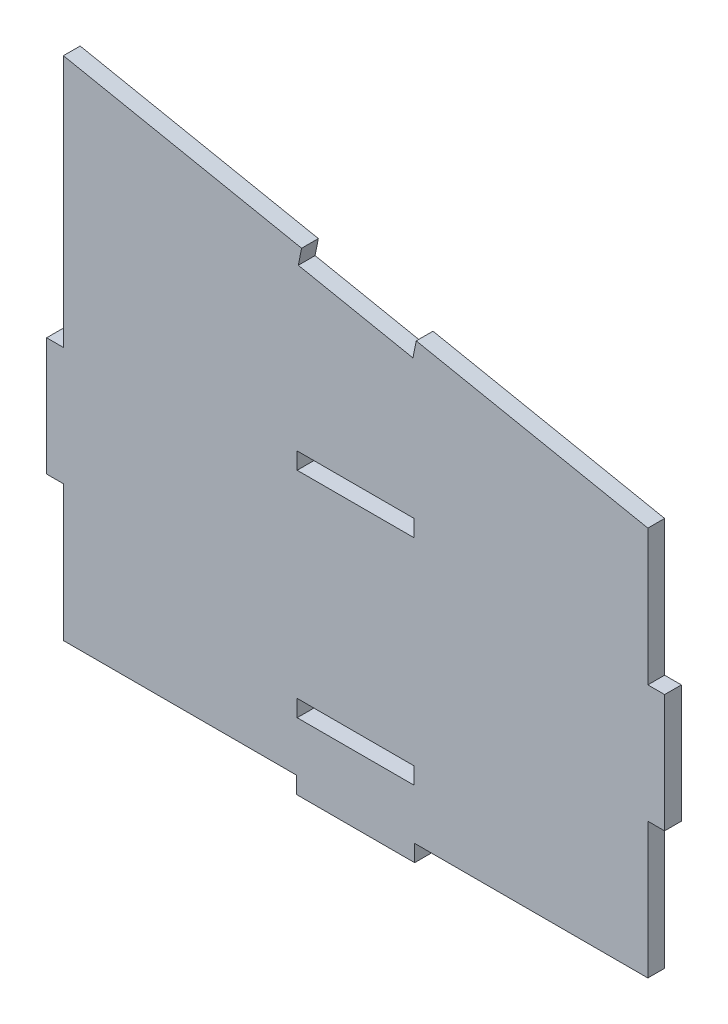
from build123d import *

# Parameters (mm, degrees)
SKETCH1_W           = 30
SKETCH1_H           = 4.3
BOSS_EXTRUDE1_DEPTH = 4.3


with BuildPart() as part:
    # Sketch1 → Boss-Extrude1 (new body)
    with BuildSketch(Plane.XY):
        Polygon((0, 130), (0, 65.15), (-4.3, 65.15), (-4.3, 34.85), (0, 34.85), (0, 0), (59.85, 0), (59.85, -4.3), (90.15, -4.3), (90.15, 0), (150, 0), (150, 34.85), (154.3, 34.85), (154.3, 65.15), (150, 65.15), (150, 100), (90.552009516, 111.889598097), (89.708710135, 107.673101191), (60.291289865, 113.556585245), (61.134589246, 117.773082151), align=None)
        with Locations((75, 15)):
            Rectangle(SKETCH1_W, SKETCH1_H, mode=Mode.SUBTRACT)
        with Locations((75, 70)):
            Rectangle(SKETCH1_W, SKETCH1_H, mode=Mode.SUBTRACT)
    extrude(amount=BOSS_EXTRUDE1_DEPTH)


solid = part.part
